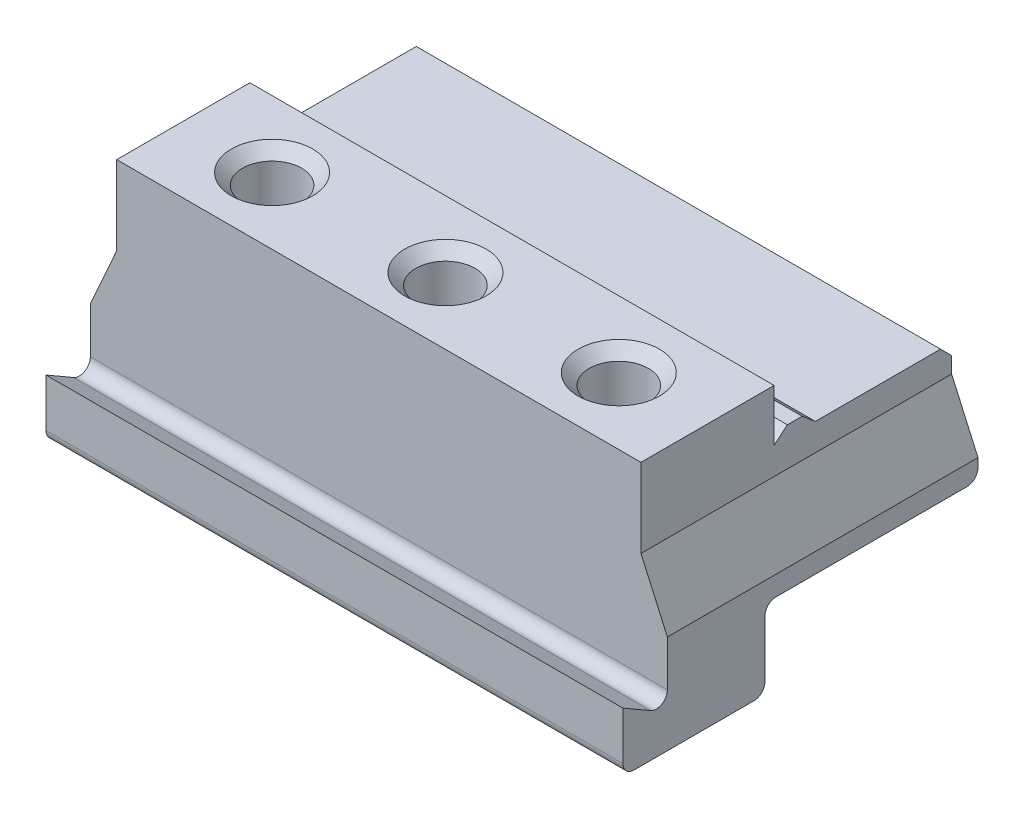
from build123d import *

# Parameters (mm, degrees)
BOSS_EXTRUDE1_START = 39
BOSS_EXTRUDE1_DEPTH = 39
CUT_EXTRUDE1_DEPTH  = 42.5
SKETCH3_R           = 4
CUT_EXTRUDE2_DEPTH  = 10
CHAMFER1_SIZE       = 1.5


with BuildPart() as part:
    # Sketch1 → Boss-Extrude1 (new, symmetric)
    with BuildSketch(Plane(origin=(0, 0, 0), x_dir=(0, 0, -1), z_dir=(1, 0, 0)).offset(BOSS_EXTRUDE1_START)):
        with BuildLine():
            Line((1.5, 0), (17.7, 0))
            ThreePointArc((17.7, 0), (18.760660172, 0.439339828), (19.2, 1.5))
            Line((19.2, 1.5), (19.2, 9.17))
            ThreePointArc((19.2, 9.17), (19.639339828, 10.230660172), (20.7, 10.67))
            Line((20.7, 10.67), (46.5, 10.67))
            ThreePointArc((46.5, 10.67), (47.560660172, 11.109339828), (48, 12.17))
            Line((48, 12.17), (48, 23.5))
            Line((48, 23.5), (46.5, 25))
            Line((46.5, 25), (29.575260778, 25))
            Line((29.575260778, 25), (27.787630389, 26.5))
            Line((27.787630389, 26.5), (25.787630389, 26.5))
            Line((25.787630389, 26.5), (24, 25))
            Line((24, 25), (24, 32))
            Line((24, 32), (6, 32))
            Line((6, 32), (6, 7.133974596))
            ThreePointArc((6, 7.133974596), (5.25, 5.834936491), (3.75, 5.834936491))
            Line((3.75, 5.834936491), (0, 8))
            Line((0, 8), (0, 1.5))
            ThreePointArc((0, 1.5), (0.439339828, 0.439339828), (1.5, 0))
        make_face()
    extrude(amount=BOSS_EXTRUDE1_DEPTH, both=True)

    # Sketch2 → Cut-Extrude1 (cut)
    with BuildSketch(Plane.XY.offset(-6)):
        Polygon((78, 13.33), (74.438170518, 21.33), (74.438170518, 32), (78, 32), align=None)
        Polygon((3.561829482, 21.33), (3.561829482, 32), (0, 32), (0, 13.33), align=None)
    extrude(amount=-CUT_EXTRUDE1_DEPTH, mode=Mode.SUBTRACT)

    # Sketch3 → Cut-Extrude2 (cut)
    with BuildSketch(Plane(origin=(0, 32, 0), x_dir=(1, 0, 0), z_dir=(0, 1, 0))):
        with Locations(Location((62.438170518, 15, 0), (0, 0, 270))):
            Circle(SKETCH3_R)
        with Locations(Location((39, 15, 0), (0, 0, 270))):
            Circle(SKETCH3_R)
        with Locations(Location((15.561829482, 15, 0), (0, 0, 90))):
            Circle(SKETCH3_R)
    extrude(amount=-CUT_EXTRUDE2_DEPTH, mode=Mode.SUBTRACT)

    # Chamfer1
    chamfer1_edges = [part.edges().sort_by_distance(p)[0] for p in [
        (62.438170518, 32, -19),
        (39, 32, -19),
        (15.561829482, 32, -11),
    ]]
    chamfer(chamfer1_edges, length=CHAMFER1_SIZE)


solid = part.part
